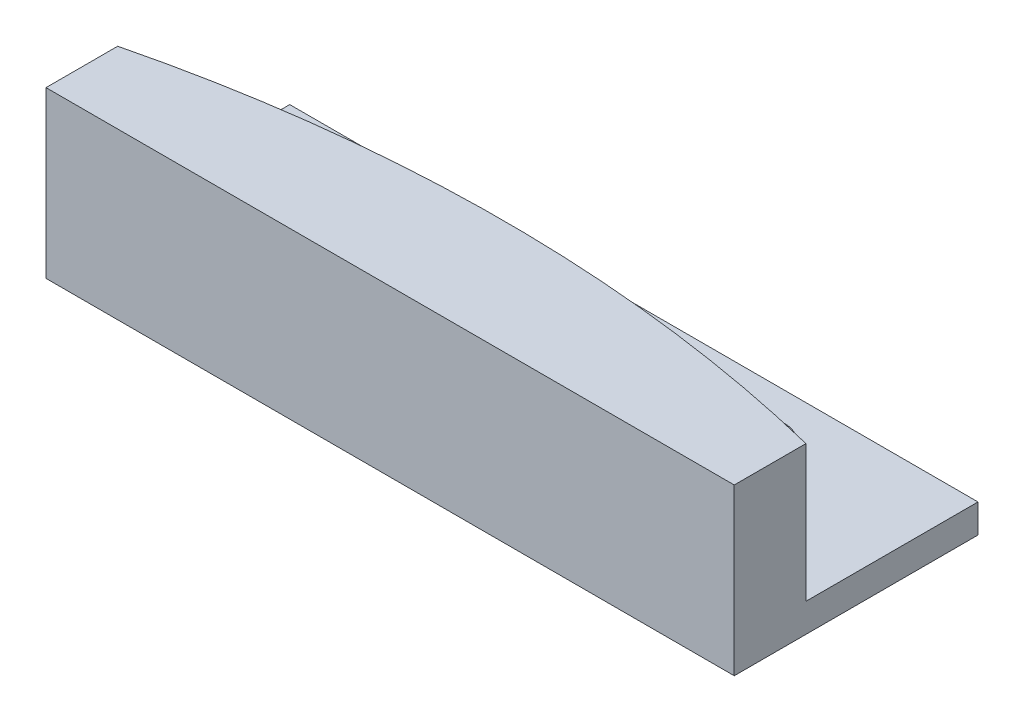
from build123d import *

# Parameters (mm, degrees)
BOSS_EXTRUDE1_DEPTH = 11.525
SKETCH1_3_R         = 2
BOSS_EXTRUDE2_DEPTH = 2


with BuildPart() as part:
    # Sketch1 → Boss-Extrude1 (new body)
    with BuildSketch(Plane(origin=(0, 0, 0), x_dir=(1, 0, 0), z_dir=(0, 1, 0))):
        with BuildLine():
            Line((-24, 5), (-24, 0))
            Line((-24, 0), (24, 0))
            Line((24, 0), (24, 5))
            ThreePointArc((24, 5), (0, 7.922711204), (-24, 5))
        make_face()
    extrude(amount=BOSS_EXTRUDE1_DEPTH)

    # Sketch1<3> → Boss-Extrude2 (add)
    with BuildSketch(Plane(origin=(0, 0, 0), x_dir=(1, 0, 0), z_dir=(0, 1, 0))):
        with BuildLine():
            Line((-24, 17), (-24, 5))
            ThreePointArc((-24, 5), (0, 7.922711204), (24, 5))
            Line((24, 5), (24, 17))
            Line((24, 17), (-24, 17))
        make_face()
        with Locations((-12.5, 13)):
            Circle(SKETCH1_3_R, mode=Mode.SUBTRACT)
        with Locations((12.5, 13)):
            Circle(SKETCH1_3_R, mode=Mode.SUBTRACT)
    extrude(amount=BOSS_EXTRUDE2_DEPTH)


solid = part.part
